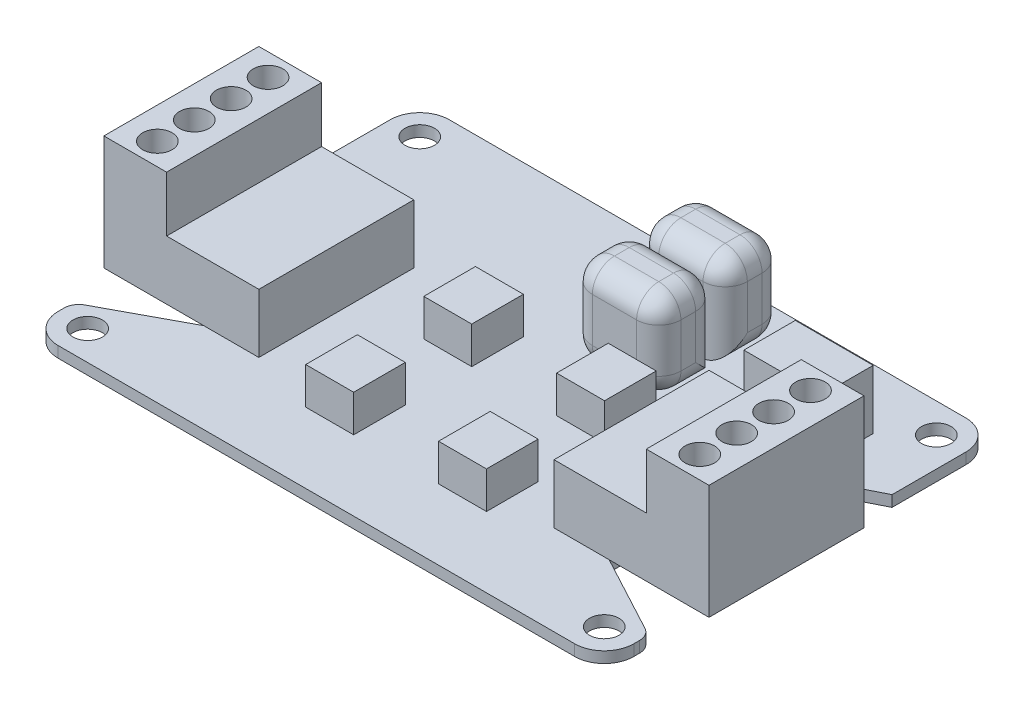
from build123d import *

# Parameters (mm, degrees)
SKETCH_1_R          = 2
EXTRUDE_1_DEPTH     = 1.5
SKETCH_2_W          = 21
SKETCH_2_H          = 21
EXTRUDE_2_DEPTH     = 8
SKETCH_3_W          = 8.5
SKETCH_3_H          = 21
EXTRUDE_3_DEPTH     = 7.5
SKETCH_4_R          = 2
CUT_EXTRUDE_1_DEPTH = 3
SKETCH_5_W          = 10.550121942
SKETCH_5_H          = 6.972400203
EXTRUDE_4_DEPTH     = 8
SKETCH_6_W          = 6.5
SKETCH_6_H          = 7
EXTRUDE_5_DEPTH     = 5
EXTRUDE_5_2_DEPTH   = 5
EXTRUDE_5_3_DEPTH   = 5
EXTRUDE_5_4_DEPTH   = 5
SKETCH_7_W          = 12
SKETCH_7_H          = 8
EXTRUDE_6_DEPTH     = 12
EXTRUDE_6_2_DEPTH   = 12
FILLET_1_R          = 3
FILLET_2_R          = 3


with BuildPart() as part:
    # 草图1 → 凸台-拉伸1 (new body)
    with BuildSketch(Plane(origin=(0, 0, 0), x_dir=(1, 0, 0), z_dir=(0, 1, 0))):
        with BuildLine():
            Line((0, 4), (0, 4.80860064))
            ThreePointArc((0, 4.80860064), (0.28367785, 5.835361702), (1.054238278, 6.570853393))
            Line((1.054238278, 6.570853393), (11.534621528, 12.195441177))
            Line((11.534621528, 12.195441177), (11.534621528, 33.195441177))
            Line((11.534621528, 33.195441177), (0, 39))
            Line((0, 39), (0, 49))
            ThreePointArc((0, 49), (1.171572875, 51.828427125), (4, 53))
            Line((4, 53), (74, 53))
            ThreePointArc((74, 53), (76.828427125, 51.828427125), (78, 49))
            Line((78, 49), (78, 39))
            Line((78, 39), (66.465378472, 33.195441177))
            Line((66.465378472, 33.195441177), (66.465378472, 12.195441177))
            Line((66.465378472, 12.195441177), (76.945761722, 6.570853393))
            ThreePointArc((76.945761722, 6.570853393), (77.71632215, 5.835361702), (78, 4.80860064))
            Line((78, 4.80860064), (78, 4))
            ThreePointArc((78, 4), (76.828427125, 1.171572875), (74, 0))
            Line((74, 0), (4, 0))
            ThreePointArc((4, 0), (1.171572875, 1.171572875), (0, 4))
        make_face()
        with Locations(Location((4, 49, 0), (0, 0, 270))):
            Circle(SKETCH_1_R, mode=Mode.SUBTRACT)
        with Locations(Location((4, 4, 0), (0, 0, 270))):
            Circle(SKETCH_1_R, mode=Mode.SUBTRACT)
        with Locations(Location((74, 49, 0), (0, 0, 270))):
            Circle(SKETCH_1_R, mode=Mode.SUBTRACT)
        with Locations(Location((74, 4, 0), (0, 0, 270))):
            Circle(SKETCH_1_R, mode=Mode.SUBTRACT)
    extrude(amount=EXTRUDE_1_DEPTH)


with BuildPart() as body_2:
    # 草图2 → 凸台-拉伸2 (new body)
    with BuildSketch(Plane(origin=(0, 1.5, 0), x_dir=(1, 0, 0), z_dir=(0, 1, 0))):
        with Locations((8.5, 22.695441177)):
            Rectangle(SKETCH_2_W, SKETCH_2_H)
    extrude_2 = extrude(amount=EXTRUDE_2_DEPTH)

    # 草图3 → 凸台-拉伸3 (add)
    with BuildSketch(Plane(origin=(0, 9.5, 0), x_dir=(1, 0, 0), z_dir=(0, 1, 0))):
        with Locations((2.25, 22.695441177)):
            Rectangle(SKETCH_3_W, SKETCH_3_H)
    extrude_3 = extrude(amount=EXTRUDE_3_DEPTH)

    # 草图4 → 切除-拉伸1 (cut)
    with BuildSketch(Plane(origin=(0, 17, 0), x_dir=(1, 0, 0), z_dir=(0, 1, 0))):
        with Locations(Location((2.25, 30.195441177, 0), (0, 0, 270))):
            Circle(SKETCH_4_R)
        with Locations(Location((2.25, 25.195441177, 0), (0, 0, 270))):
            Circle(SKETCH_4_R)
        with Locations(Location((2.25, 20.195441177, 0), (0, 0, 270))):
            Circle(SKETCH_4_R)
        with Locations(Location((2.25, 15.195441177, 0), (0, 0, 270))):
            Circle(SKETCH_4_R)
    cut_extrude_1 = extrude(amount=-CUT_EXTRUDE_1_DEPTH, mode=Mode.SUBTRACT)


with BuildPart() as part_1:
    add(part.part)

    # 镜向1: 凸台-拉伸2, 凸台-拉伸3, 切除-拉伸1 across plane
    add(extrude_2.mirror(Plane(origin=(39, 0, 0), x_dir=(0, 0, 1), z_dir=(1, 0, 0))))
    add(extrude_3.mirror(Plane(origin=(39, 0, 0), x_dir=(0, 0, 1), z_dir=(1, 0, 0))))
    add(cut_extrude_1.mirror(Plane(origin=(39, 0, 0), x_dir=(0, 0, 1), z_dir=(1, 0, 0))), mode=Mode.SUBTRACT)

    # 草图5 → 凸台-拉伸4 (add)
    with BuildSketch(Plane(origin=(0, 1.5, 0), x_dir=(1, 0, 0), z_dir=(0, 1, 0))):
        with Locations((64.275060971, 41.40809254)):
            Rectangle(SKETCH_5_W, SKETCH_5_H)
    extrude(amount=EXTRUDE_4_DEPTH)


with BuildPart() as body_3:
    # 草图6 → 凸台-拉伸5 (new body)
    with BuildSketch(Plane(origin=(0, 1.5, 0), x_dir=(1, 0, 0), z_dir=(0, 1, 0))):
        with Locations((31.252521601, 29.040878977)):
            Rectangle(SKETCH_6_W, SKETCH_6_H)
    extrude(amount=EXTRUDE_5_DEPTH)


with BuildPart() as body_4:
    # 草图6 → Extrude 5 2 (new body)
    with BuildSketch(Plane(origin=(0, 1.5, 0), x_dir=(1, 0, 0), z_dir=(0, 1, 0))):
        with Locations((49.252521601, 29.040878977)):
            Rectangle(SKETCH_6_W, SKETCH_6_H)
    extrude(amount=EXTRUDE_5_2_DEPTH)


with BuildPart() as body_5:
    # 草图6 → Extrude 5 3 (new body)
    with BuildSketch(Plane(origin=(0, 1.5, 0), x_dir=(1, 0, 0), z_dir=(0, 1, 0))):
        with Locations((49.252521601, 13.040878977)):
            Rectangle(SKETCH_6_W, SKETCH_6_H)
    extrude(amount=EXTRUDE_5_3_DEPTH)


with BuildPart() as body_6:
    # 草图6 → Extrude 5 4 (new body)
    with BuildSketch(Plane(origin=(0, 1.5, 0), x_dir=(1, 0, 0), z_dir=(0, 1, 0))):
        with Locations((31.252521601, 13.040878977)):
            Rectangle(SKETCH_6_W, SKETCH_6_H)
    extrude(amount=EXTRUDE_5_4_DEPTH)


with BuildPart() as body_7:
    # 草图7 → 凸台-拉伸6 (new body)
    with BuildSketch(Plane(origin=(0, 1.5, 0), x_dir=(1, 0, 0), z_dir=(0, 1, 0))):
        with Locations((46.192647403, 37.195441177)):
            Rectangle(SKETCH_7_W, SKETCH_7_H)
    extrude(amount=EXTRUDE_6_DEPTH)

    # 圆角2
    fillet_2_edges = [body_7.edges().sort_by_distance(p)[0] for p in [
        (40.192647403, 13.5, -37.195441177),
        (46.192647403, 13.5, -33.195441177),
        (52.192647403, 13.5, -37.195441177),
        (46.192647403, 1.5, -33.195441177),
        (40.192647403, 1.5, -37.195441177),
        (52.192647403, 1.5, -37.195441177),
        (46.192647403, 13.5, -41.195441177),
        (52.192647403, 7.5, -33.195441177),
        (40.192647403, 7.5, -33.195441177),
        (40.192647403, 7.5, -41.195441177),
        (52.192647403, 7.5, -41.195441177),
    ]]
    fillet(fillet_2_edges, radius=FILLET_2_R)


with BuildPart() as body_8:
    # 草图7 → Extrude 6 2 (new body)
    with BuildSketch(Plane(origin=(0, 1.5, 0), x_dir=(1, 0, 0), z_dir=(0, 1, 0))):
        with Locations((46.192647403, 46.195441177)):
            Rectangle(SKETCH_7_W, SKETCH_7_H)
    extrude(amount=EXTRUDE_6_2_DEPTH)

    # 圆角1
    fillet_1_edges = [body_8.edges().sort_by_distance(p)[0] for p in [
        (46.192647403, 13.5, -50.195441177),
        (40.192647403, 13.5, -46.195441177),
        (46.192647403, 13.5, -42.195441177),
        (40.192647403, 1.5, -46.195441177),
        (46.192647403, 1.5, -50.195441177),
        (52.192647403, 1.5, -46.195441177),
        (52.192647403, 13.5, -46.195441177),
        (40.192647403, 7.5, -42.195441177),
        (40.192647403, 7.5, -50.195441177),
        (52.192647403, 7.5, -50.195441177),
        (52.192647403, 7.5, -42.195441177),
    ]]
    fillet(fillet_1_edges, radius=FILLET_1_R)


solid = Compound([body_2.part, part_1.part, body_3.part, body_4.part, body_5.part, body_6.part, body_7.part, body_8.part])
